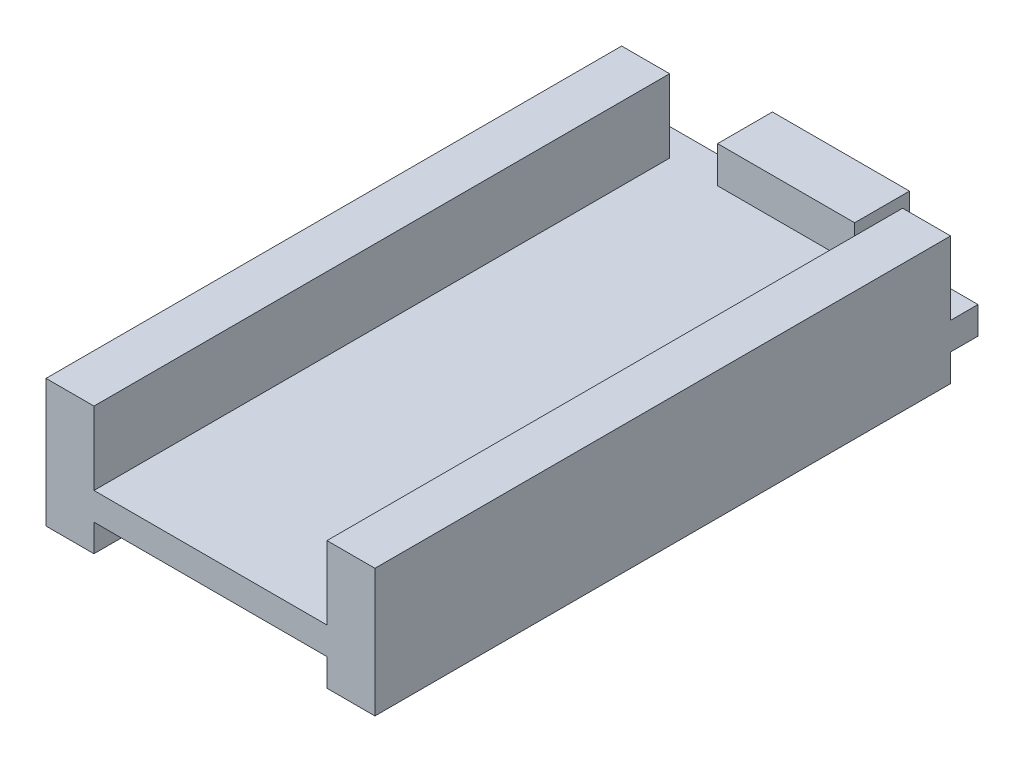
from build123d import *

# Parameters (mm, degrees)
SKETCH1_W                = 2.625
SKETCH1_H                = 31.5
SKETCH1_W_2              = 7.5
SKETCH1_H_2              = 1.5
BOSS_EXTRUDE1_DEPTH      = 1.5
BOSS_EXTRUDE2_START      = 1.5
SKETCH1_3_W              = 7.5
SKETCH1_3_H              = 3
BOSS_EXTRUDE2_DEPTH      = 2
BOSS_EXTRUDE3_DEPTH      = 4
BOSS_EXTRUDE3_DEPTH_BACK = 3
BOSS_EXTRUDE3_START      = 1.5
SKETCH1_4_W              = 2.625
SKETCH1_4_H              = 31.5


with BuildPart() as part:
    # Sketch1 → Boss-Extrude1 (new body)
    with BuildSketch(Plane(origin=(0, 0, 0), x_dir=(1, 0, 0), z_dir=(0, 1, 0))):
        Polygon((-6.375, 15), (-6.375, -16.5), (6.375, -16.5), (6.375, 15), (9, 15), (9, 16.5), (3.75, 16.5), (3.75, 15), (-3.75, 15), (-3.75, 16.5), (-9, 16.5), (-9, 15), align=None)
        with Locations((-7.6875, -0.75)):
            Rectangle(SKETCH1_W, SKETCH1_H)
        with Locations((7.6875, -0.75)):
            Rectangle(SKETCH1_W, SKETCH1_H)
        with Locations((0, 15.75)):
            Rectangle(SKETCH1_W_2, SKETCH1_H_2)
    extrude(amount=BOSS_EXTRUDE1_DEPTH)

    # Sketch1<3> → Boss-Extrude2 (add)
    with BuildSketch(Plane(origin=(0, 0, 0), x_dir=(1, 0, 0), z_dir=(0, 1, 0)).offset(BOSS_EXTRUDE2_START)):
        with Locations((0, 16.5)):
            Rectangle(SKETCH1_3_W, SKETCH1_3_H)
    extrude(amount=BOSS_EXTRUDE2_DEPTH)

    # Sketch1<4> → Boss-Extrude3 (add, two sides: drawn at the far end of the back side and taken through both)
    with BuildSketch(Plane(origin=(0, 0, 0), x_dir=(1, 0, 0), z_dir=(0, 1, 0)).offset(BOSS_EXTRUDE3_START - BOSS_EXTRUDE3_DEPTH_BACK)):
        with Locations((-7.6875, -0.75)):
            Rectangle(SKETCH1_4_W, SKETCH1_4_H)
        with Locations((7.6875, -0.75)):
            Rectangle(SKETCH1_4_W, SKETCH1_4_H)
    extrude(amount=BOSS_EXTRUDE3_DEPTH + BOSS_EXTRUDE3_DEPTH_BACK)


solid = part.part
